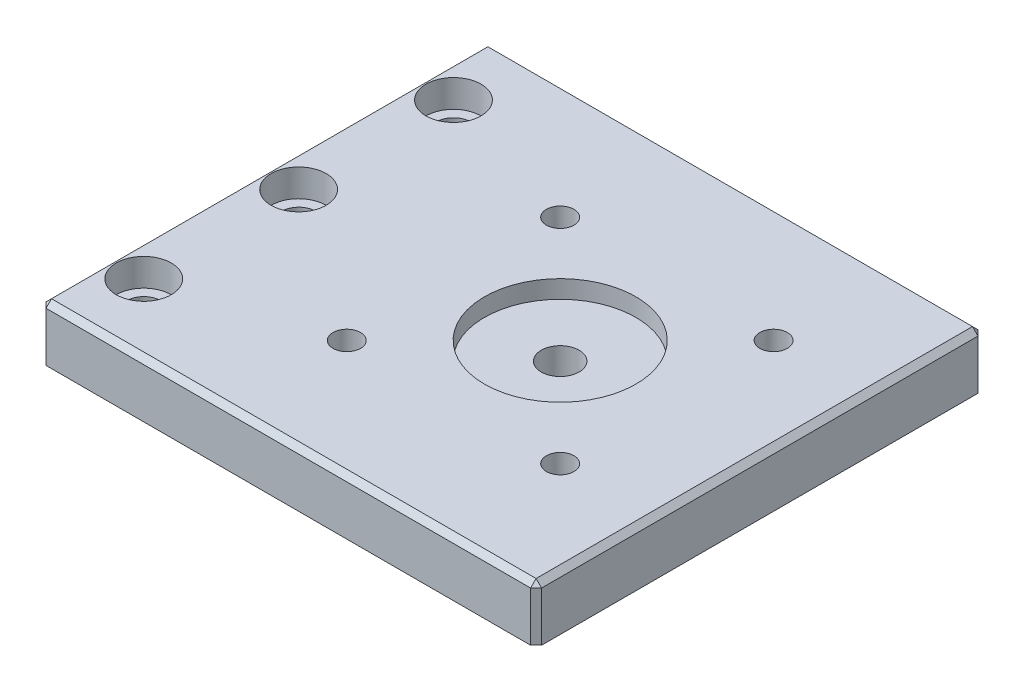
from build123d import *

# Parameters (mm, degrees)
SKETCH_1_W                = 72
SKETCH_1_H                = 65
EXTRUDE_1_DEPTH           = 4
HOLE_WIZARD_1_D           = 5.5
HOLE_WIZARD_1_DEPTH       = 100
HOLE_WIZARD_1_CBORE_D     = 22
HOLE_WIZARD_1_CBORE_DEPTH = 2.6
HOLE_WIZARD_2_D           = 4
HOLE_WIZARD_2_DEPTH       = 100
HOLE_WIZARD_2_CBORE_D     = 6
HOLE_WIZARD_2_CBORE_DEPTH = 3
HOLE_WIZARD_3_D           = 5
HOLE_WIZARD_3_DEPTH       = 100
HOLE_WIZARD_3_CBORE_D     = 8
HOLE_WIZARD_3_CBORE_DEPTH = 4
CHAMFER_1_SIZE            = 0.8


with BuildPart() as part:
    # 草图1 → 凸台-拉伸1 (new, symmetric)
    with BuildSketch(Plane(origin=(0, 0, 0), x_dir=(1, 0, 0), z_dir=(0, 1, 0))):
        Rectangle(SKETCH_1_W, SKETCH_1_H)
    extrude(amount=EXTRUDE_1_DEPTH, both=True)

    # 孔1
    with Locations(Plane(origin=(0, 4, 0), x_dir=(1, 0, 0), z_dir=(0, 1, 0))):
        with Locations((7, 0)):
            CounterBoreHole(HOLE_WIZARD_1_D / 2, HOLE_WIZARD_1_CBORE_D / 2, HOLE_WIZARD_1_CBORE_DEPTH, depth=HOLE_WIZARD_1_DEPTH)

    # 孔2
    with Locations(Plane(origin=(0, -4, 0), x_dir=(-1, 0, 0), z_dir=(0, -1, 0))):
        with Locations((-22.5, 15.5), (8.5, 15.5), (8.5, -15.5), (-22.5, -15.5)):
            CounterBoreHole(HOLE_WIZARD_2_D / 2, HOLE_WIZARD_2_CBORE_D / 2, HOLE_WIZARD_2_CBORE_DEPTH, depth=HOLE_WIZARD_2_DEPTH)

    # 孔3
    with Locations(Plane(origin=(0, 4, 0), x_dir=(1, 0, 0), z_dir=(0, 1, 0))):
        with Locations((-31, 22.5), (-31, 0), (-31, -22.5)):
            CounterBoreHole(HOLE_WIZARD_3_D / 2, HOLE_WIZARD_3_CBORE_D / 2, HOLE_WIZARD_3_CBORE_DEPTH, depth=HOLE_WIZARD_3_DEPTH)

    # 倒角1
    chamfer_1_edges = [part.edges().sort_by_distance(p)[0] for p in [
        (-36, 4, 0),
        (0, 4, 32.5),
        (36, 4, 0),
        (36, 0, 32.5),
        (-36, 0, 32.5),
        (-36, 0, -32.5),
        (36, 0, -32.5),
        (0, 4, -32.5),
    ]]
    chamfer(chamfer_1_edges, length=CHAMFER_1_SIZE)


solid = part.part
